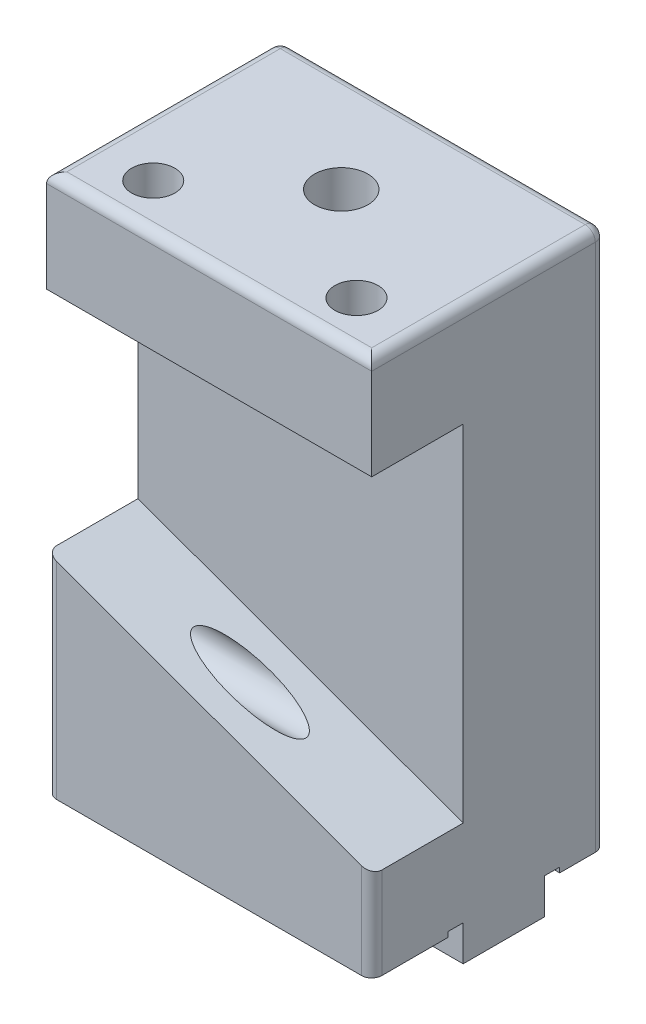
from build123d import *

# Parameters (mm, degrees)
SKETCH4_W              = 64
SKETCH4_H              = 112
BOSS_EXTRUDE1_DEPTH    = 46
CUT_EXTRUDE1_DEPTH     = 18
CUT_EXTRUDE2_DEPTH     = 90
SKETCH7_R              = 5.25
CUT_EXTRUDE3_DEPTH     = 273
M10_TAPPED_HOLE2_D     = 8.5
M10_TAPPED_HOLE2_DEPTH = 50
M10_TAPPED_HOLE2_TIP   = 2.553657631
SKETCH10_R             = 5
CUT_EXTRUDE4_DEPTH     = 6
SKETCH12_R             = 4
CUT_EXTRUDE5_DEPTH     = 50
FILLET1_R              = 2


with BuildPart() as part:
    # Sketch4 → Boss-Extrude1 (new body)
    with BuildSketch(Plane.XY):
        with Locations((-87.370786517, 151.325842697)):
            Rectangle(SKETCH4_W, SKETCH4_H)
    extrude(amount=BOSS_EXTRUDE1_DEPTH)

    # Sketch5 → Cut-Extrude1 (cut)
    with BuildSketch(Plane.XY.offset(46)):
        Polygon((-119.370786517, 187.325842697), (-55.370786517, 187.325842697), (-55.370786517, 119.325842697), (-119.370786517, 142.61993769), align=None)
    extrude(amount=-CUT_EXTRUDE1_DEPTH, mode=Mode.SUBTRACT)

    # Sketch6 → Cut-Extrude2 (cut)
    with BuildSketch(Plane(origin=(-55.370786517, 0, 0), x_dir=(0, 0, -1), z_dir=(1, 0, 0))):
        Polygon((-46, 101.325842697), (-31, 101.325842697), (-31, 102.325842697), (-28, 102.325842697), (-28, 95.325842697), (-46, 95.325842697), align=None)
        Polygon((-12, 95.325842697), (-12, 101.565088044), (-12, 102.325842697), (-9, 102.325842697), (-9, 101.325842697), (0, 101.325842697), (0, 95.325842697), align=None)
    extrude(amount=-CUT_EXTRUDE2_DEPTH, mode=Mode.SUBTRACT)

    # Sketch7 → Cut-Extrude3 (cut)
    with BuildSketch(Plane(origin=(0, 207.325842697, 0), x_dir=(1, 0, 0), z_dir=(0, 1, 0))):
        with Locations(Location((-87.370786517, -20, 0), (0, 0, 270))):
            Circle(SKETCH7_R)
    extrude(amount=-CUT_EXTRUDE3_DEPTH, mode=Mode.SUBTRACT)

    # M10 Tapped Hole2
    with Locations(Plane(origin=(-107.370786517, 207.325842697, 37), x_dir=(0, 0, 1), z_dir=(0, 1, 0))):
        with Locations((0, 0), (0, 40)):
            Hole(M10_TAPPED_HOLE2_D / 2, depth=M10_TAPPED_HOLE2_DEPTH)
            with Locations((0, 0, -(M10_TAPPED_HOLE2_DEPTH + M10_TAPPED_HOLE2_TIP / 2))):  # 118° drill point
                Cone(0, M10_TAPPED_HOLE2_D / 2, M10_TAPPED_HOLE2_TIP, mode=Mode.SUBTRACT)

    # Sketch10 → Cut-Extrude4 (cut)
    with BuildSketch(Plane.ZY.offset(119.370786517)):
        with Locations(Location((37, 131.325842697, 0), (0, 0, 270))):
            Circle(SKETCH10_R)
    extrude(amount=-CUT_EXTRUDE4_DEPTH, mode=Mode.SUBTRACT)

    # Sketch12 → Cut-Extrude5 (cut)
    with BuildSketch(Plane.ZY.offset(113.370786517)):
        with Locations(Location((37, 131.325842697, 0), (0, 0, 270))):
            Circle(SKETCH12_R)
    extrude(amount=-CUT_EXTRUDE5_DEPTH, mode=Mode.SUBTRACT)

    # Fillet1
    fillet1_edges = [part.edges().sort_by_distance(p)[0] for p in [
        (-55.370786517, 110.325842697, 46),
        (-119.370786517, 121.972890193, 46),
        (-119.370786517, 154.325842697, 0),
        (-87.370786517, 207.325842697, 0),
        (-55.370786517, 154.325842697, 0),
        (-55.370786517, 207.325842697, 23),
        (-87.370786517, 207.325842697, 46),
        (-119.370786517, 207.325842697, 23),
    ]]
    fillet(fillet1_edges, radius=FILLET1_R)


solid = part.part
